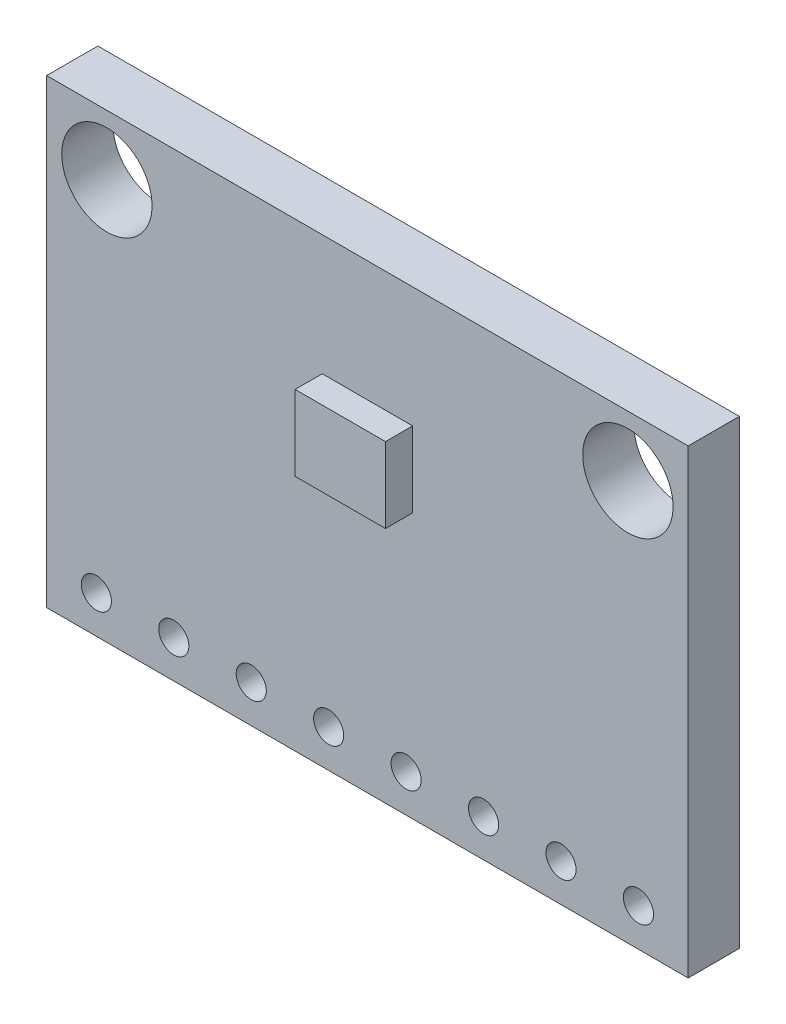
from build123d import *

# Parameters (mm, degrees)
SKETCH1_W           = 21.3
SKETCH1_H           = 15.3
BOSS_EXTRUDE1_DEPTH = 1.7
BOSS_EXTRUDE2_START = 1.7
SKETCH1_3_W         = 3
SKETCH1_3_H         = 2.5
BOSS_EXTRUDE2_DEPTH = 0.9
SKETCH1_4_R         = 0.5
SKETCH1_4_R_2       = 1.5
CUT_EXTRUDE1_DEPTH  = 14.368058947


with BuildPart() as part:
    # Sketch1 → Boss-Extrude1 (new body)
    with BuildSketch(Plane.XY):
        Rectangle(SKETCH1_W, SKETCH1_H)
    extrude(amount=BOSS_EXTRUDE1_DEPTH)

    # Sketch1<3> → Boss-Extrude2 (add)
    with BuildSketch(Plane.XY.offset(BOSS_EXTRUDE2_START)):
        with Locations((0, 2.4)):
            Rectangle(SKETCH1_3_W, SKETCH1_3_H)
    extrude(amount=BOSS_EXTRUDE2_DEPTH)

    # Sketch1<4> → Cut-Extrude1 (cut, through all)
    with BuildSketch(Plane.XY):
        with Locations(Location((3.857142857, -6.4, 0), (0, 0, 180))):
            Circle(SKETCH1_4_R)
        with Locations(Location((-8.65, 5.65, 0), (0, 0, 180))):
            Circle(SKETCH1_4_R_2)
        with Locations(Location((8.65, 5.65, 0), (0, 0, 180))):
            Circle(SKETCH1_4_R_2)
        with Locations(Location((-9, -6.4, 0), (0, 0, 180))):
            Circle(SKETCH1_4_R)
        with Locations(Location((-6.428571429, -6.4, 0), (0, 0, 180))):
            Circle(SKETCH1_4_R)
        with Locations(Location((-3.857142857, -6.4, 0), (0, 0, 180))):
            Circle(SKETCH1_4_R)
        with Locations(Location((-1.285714286, -6.4, 0), (0, 0, 180))):
            Circle(SKETCH1_4_R)
        with Locations(Location((1.285714286, -6.4, 0), (0, 0, 180))):
            Circle(SKETCH1_4_R)
        with Locations(Location((6.428571429, -6.4, 0), (0, 0, 180))):
            Circle(SKETCH1_4_R)
        with Locations(Location((9, -6.4, 0), (0, 0, 180))):
            Circle(SKETCH1_4_R)
    extrude(amount=CUT_EXTRUDE1_DEPTH, mode=Mode.SUBTRACT)


solid = part.part
